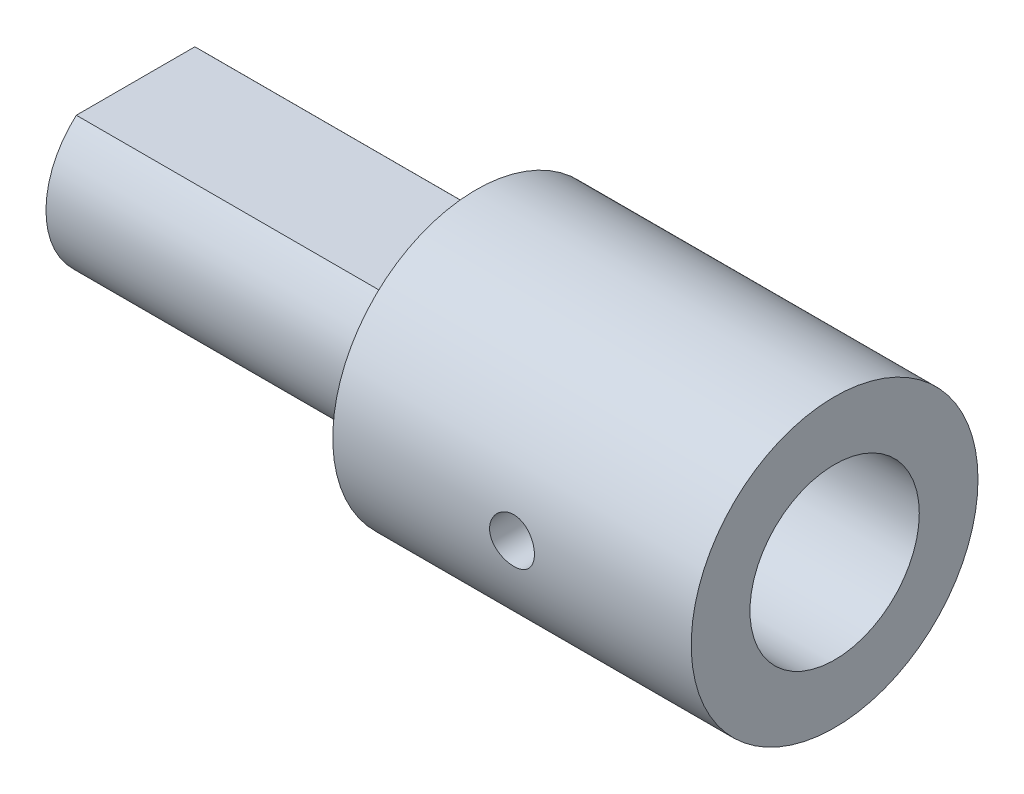
from build123d import *

# Parameters (mm, degrees)
SKETCH1_R               = 5.08
BOSS_EXTRUDE1_DEPTH     = 12.7
SKETCH2_R               = 2.999994
CUT_EXTRUDE1_DEPTH      = 9.541256
SKETCH3_R               = 3.175
BOSS_EXTRUDE2_DEPTH     = 12.065
CUT_EXTRUDE2_DEPTH      = 7.62
CUT_EXTRUDE2_DEPTH_BACK = 7.62
SKETCH4_R               = 0.79375
SKETCH7_W               = 0.79375
SKETCH7_H               = 4.200130206
CUT_EXTRUDE3_DEPTH      = 12.065


with BuildPart() as part:
    # Sketch1 → Boss-Extrude1 (new body)
    with BuildSketch(Plane.YZ):
        Circle(SKETCH1_R)
    extrude(amount=BOSS_EXTRUDE1_DEPTH)

    # Sketch2 → Cut-Extrude1 (cut)
    with BuildSketch(Plane.YZ.offset(12.7)):
        Circle(SKETCH2_R)
    extrude(amount=-CUT_EXTRUDE1_DEPTH, mode=Mode.SUBTRACT)

    # Sketch3 → Boss-Extrude2 (add)
    with BuildSketch(Plane(origin=(0, 0, 0), x_dir=(0, -1, 0), z_dir=(-1, 0, 0))):
        Circle(SKETCH3_R)
    extrude(amount=BOSS_EXTRUDE2_DEPTH)

    # Sketch4 → Cut-Extrude2 (cut, two sides: drawn at the far end of the back side and taken through both)
    with BuildSketch(Plane(origin=(0, 0, 0), x_dir=(0, 1, 0), z_dir=(0, 0, 1)).offset(-CUT_EXTRUDE2_DEPTH_BACK)):
        with Locations((0, -6.35)):
            Circle(SKETCH4_R)
    extrude(amount=CUT_EXTRUDE2_DEPTH + CUT_EXTRUDE2_DEPTH_BACK, mode=Mode.SUBTRACT)

    # Sketch7 → Cut-Extrude3 (cut)
    with BuildSketch(Plane(origin=(-12.065, 0, 0), x_dir=(0, -1, 0), z_dir=(-1, 0, 0))):
        with Locations((-2.778125, 0)):
            Rectangle(SKETCH7_W, SKETCH7_H)
    extrude(amount=-CUT_EXTRUDE3_DEPTH, mode=Mode.SUBTRACT)


solid = part.part
